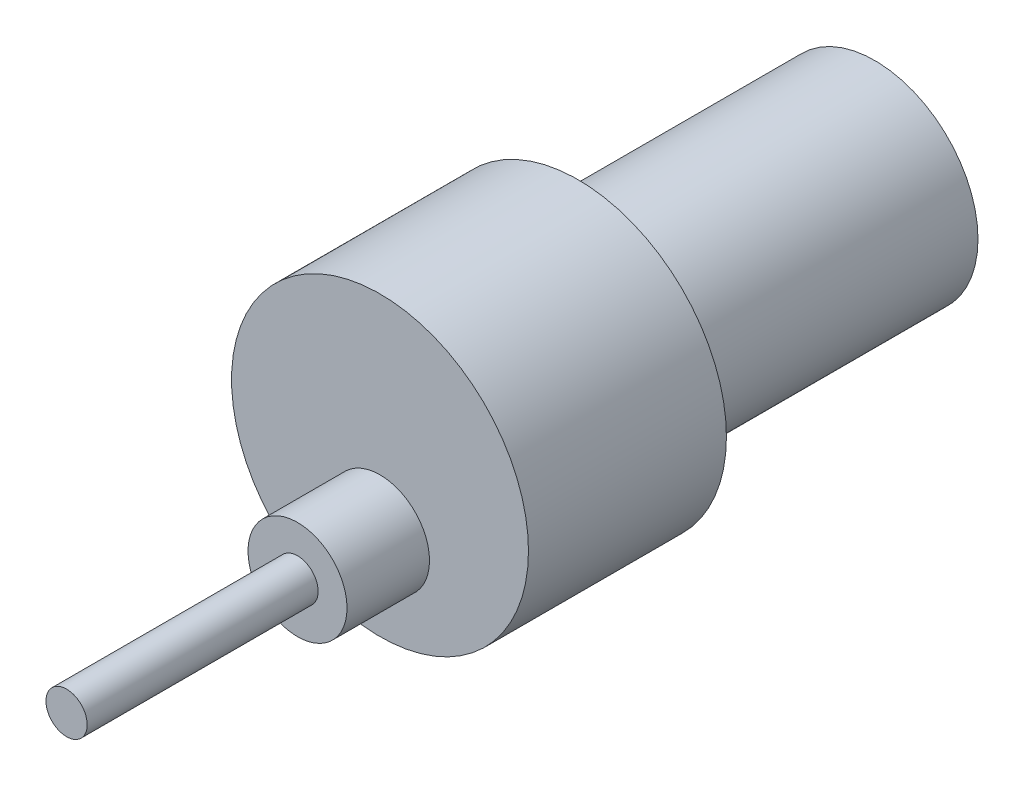
from build123d import *

# Parameters (mm, degrees)
SKETCH1_R           = 12.5
BOSS_EXTRUDE1_DEPTH = 36
SKETCH2_R           = 5
BOSS_EXTRUDE2_DEPTH = 4
SKETCH3_R           = 18
BOSS_EXTRUDE3_DEPTH = 24
SKETCH5_R           = 6
BOSS_EXTRUDE4_DEPTH = 10
SKETCH7_R           = 2.5
BOSS_EXTRUDE5_DEPTH = 28


with BuildPart() as part:
    # Sketch1 → Boss-Extrude1 (new body)
    with BuildSketch(Plane.XY):
        Circle(SKETCH1_R)
    extrude(amount=BOSS_EXTRUDE1_DEPTH)

    # Sketch2 → Boss-Extrude2 (add)
    with BuildSketch(Plane(origin=(0, 0, 0), x_dir=(-1, 0, 0), z_dir=(0, 0, -1))):
        Circle(SKETCH2_R)
    extrude(amount=BOSS_EXTRUDE2_DEPTH)

    # Sketch3 → Boss-Extrude3 (add)
    with BuildSketch(Plane.XY.offset(36)):
        Circle(SKETCH3_R)
    extrude(amount=BOSS_EXTRUDE3_DEPTH)

    # Sketch5 → Boss-Extrude4 (add)
    with BuildSketch(Plane.XY.offset(60)):
        with Locations((0, -7)):
            Circle(SKETCH5_R)
    extrude(amount=BOSS_EXTRUDE4_DEPTH)

    # Sketch7 → Boss-Extrude5 (add)
    with BuildSketch(Plane.XY.offset(70)):
        with Locations((0, -7)):
            Circle(SKETCH7_R)
    extrude(amount=BOSS_EXTRUDE5_DEPTH)


solid = part.part
